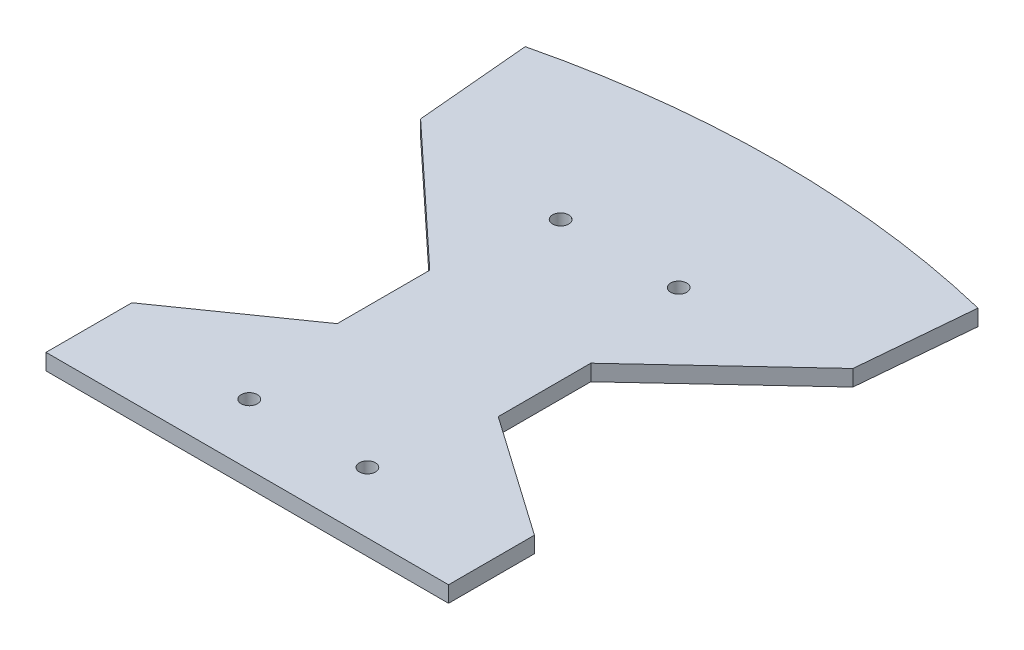
from build123d import *

# Parameters (mm, degrees)
BOSS_EXTRUDE1_DEPTH = 3
SKETCH3_R           = 1.5
CUT_EXTRUDE1_DEPTH  = 128.116518704


with BuildPart() as part:
    # Sketch2 → Boss-Extrude1 (new body)
    with BuildSketch(Plane(origin=(0, 0, 0), x_dir=(1, 0, 0), z_dir=(0, 1, 0))):
        with BuildLine():
            Line((0, 0), (75, 0))
            Line((75, 0), (75, 16))
            Line((75, 16), (60.175624146, 26.380139722))
            Line((60.175624146, 26.380139722), (52.5, 31.75466961))
            Line((52.5, 31.75466961), (52.5, 49))
            Line((52.5, 49), (77.774698645, 72.564473175))
            Line((77.774698645, 72.564473175), (79.67816092, 93.959773343))
            ThreePointArc((79.67816092, 93.959773343), (37.5, 99), (-4.67816092, 93.959773343))
            Line((-4.67816092, 93.959773343), (-2.774698645, 72.564473175))
            Line((-2.774698645, 72.564473175), (22.5, 49))
            Line((22.5, 49), (22.5, 31.75466961))
            Line((22.5, 31.75466961), (14.824375854, 26.380139722))
            Line((14.824375854, 26.380139722), (0, 16))
            Line((0, 16), (0, 0))
        make_face()
    extrude(amount=BOSS_EXTRUDE1_DEPTH)

    # Sketch3 → Cut-Extrude1 (cut, through all)
    with BuildSketch(Plane(origin=(0, 3, 0), x_dir=(1, 0, 0), z_dir=(0, 1, 0))):
        with Locations(Location((26.5, 69.377334805, 0), (0, 0, 270))):
            Circle(SKETCH3_R)
        with Locations(Location((48.5, 69.377334805, 0), (0, 0, 90))):
            Circle(SKETCH3_R)
        with Locations(Location((48.5, 11.377334805, 0), (0, 0, 270))):
            Circle(SKETCH3_R)
        with Locations(Location((26.5, 11.377334805, 0), (0, 0, 90))):
            Circle(SKETCH3_R)
    extrude(amount=-CUT_EXTRUDE1_DEPTH, mode=Mode.SUBTRACT)


solid = part.part
